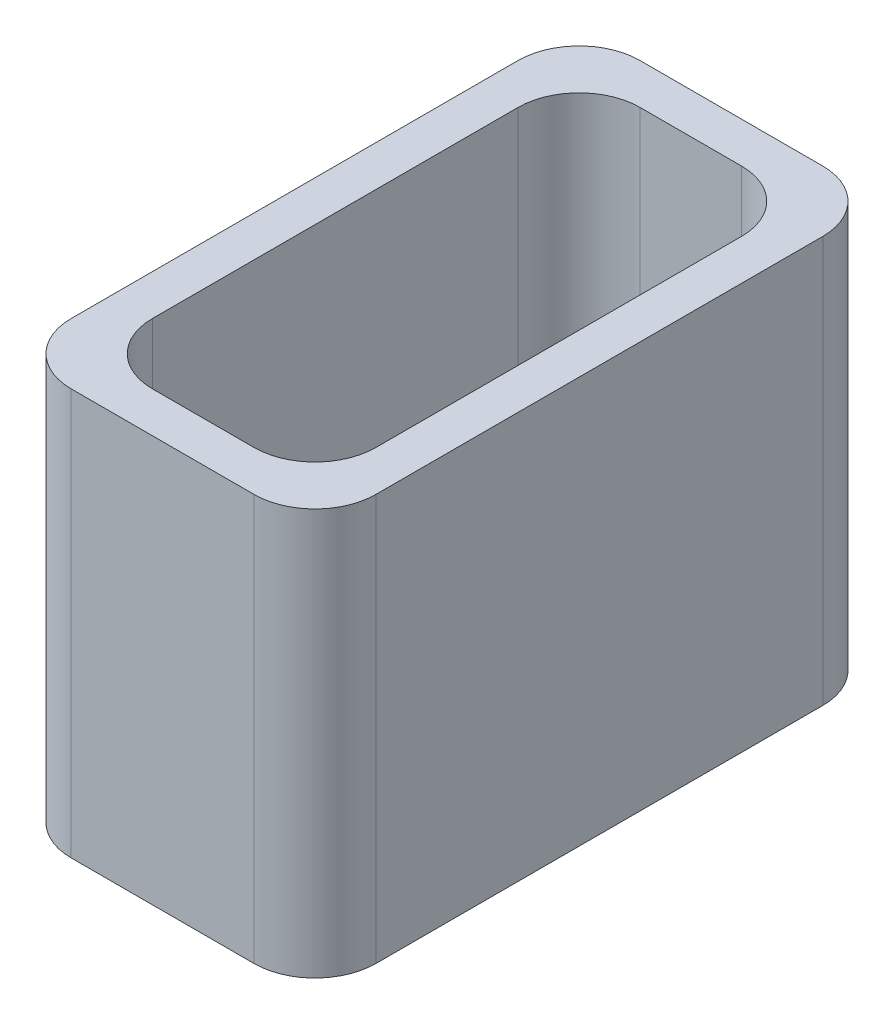
from build123d import *

# Parameters (mm, degrees)
CROQUIS1_W              = 7.5
CROQUIS1_H              = 14
CROQUIS1_W_2            = 5.5
CROQUIS1_H_2            = 12
SALIENTE_EXTRUIR1_DEPTH = 10
REDONDEO1_R             = 1.5


with BuildPart() as part:
    # Croquis1 → Saliente-Extruir1 (new body)
    with BuildSketch(Plane(origin=(0, 0, 0), x_dir=(1, 0, 0), z_dir=(0, 1, 0))):
        with Locations((-2.75, -6)):
            Rectangle(CROQUIS1_W, CROQUIS1_H)
        with Locations((-2.75, -6)):
            Rectangle(CROQUIS1_W_2, CROQUIS1_H_2, mode=Mode.SUBTRACT)
    extrude(amount=SALIENTE_EXTRUIR1_DEPTH)

    # Redondeo1
    redondeo1_edges = [part.edges().sort_by_distance(p)[0] for p in [
        (0, 5, 12),
        (0, 5, 0),
        (-5.5, 5, 0),
        (-5.5, 5, 12),
        (1, 5, -1),
        (1, 5, 13),
        (-6.5, 5, 13),
        (-6.5, 5, -1),
    ]]
    fillet(redondeo1_edges, radius=REDONDEO1_R)


solid = part.part
